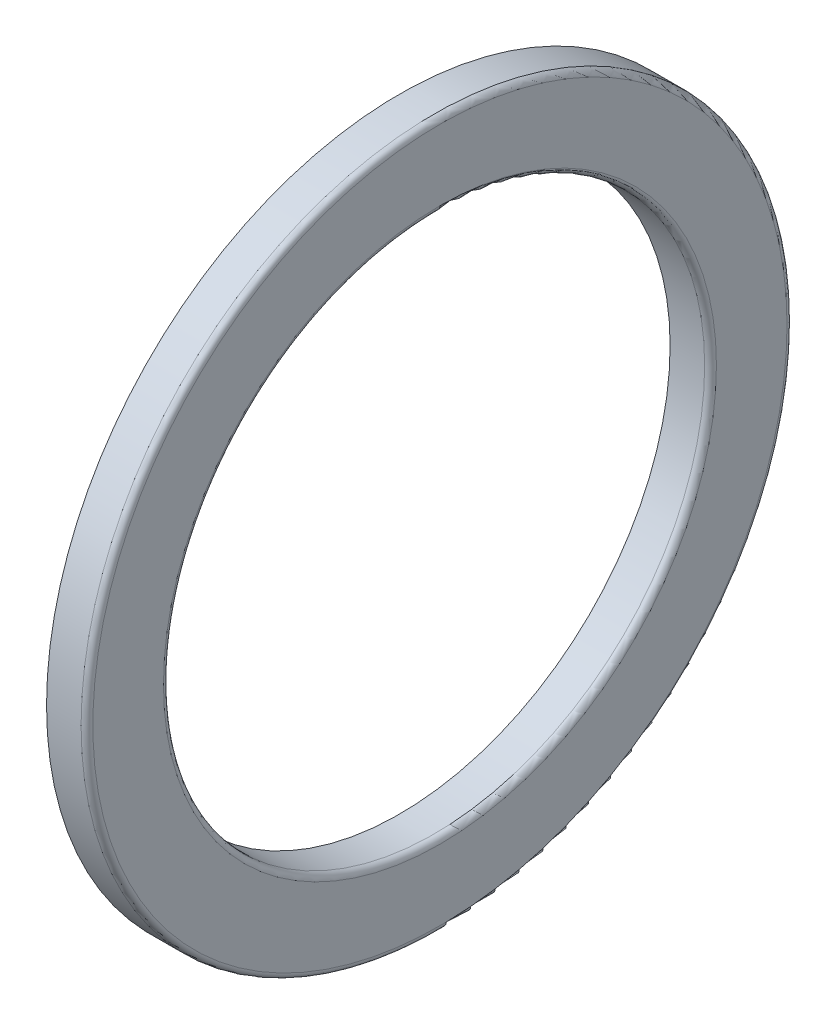
from build123d import *


with BuildPart() as part:
    # Sketch1 → Revolve1 (revolve)
    with BuildSketch(Plane.XY, mode=Mode.PRIVATE) as revolve1_sk:
        with BuildLine():
            Line((15.1276, 60), (15.1276, 55.5957))
            ThreePointArc((15.1276, 55.5957), (16.1595, 52.5), (15.1276, 49.4043))
            Line((15.1276, 49.4043), (15.1276, 46))
            Line((15.1276, 46), (21, 46))
            ThreePointArc((21, 46), (21.707106781, 46.292893219), (22, 47))
            Line((22, 47), (22, 58.99998846))
            ThreePointArc((22, 58.99998846), (21.707110861, 59.707102701), (21, 60))
            Line((21, 60), (15.1276, 60))
        make_face()
    revolve(revolve1_sk.sketch.rotate(Axis((15.1276, 0, 0), (1, 0, 0)), 270), axis=Axis((15.1276, 0, 0), (1, 0, 0)))


solid = part.part
